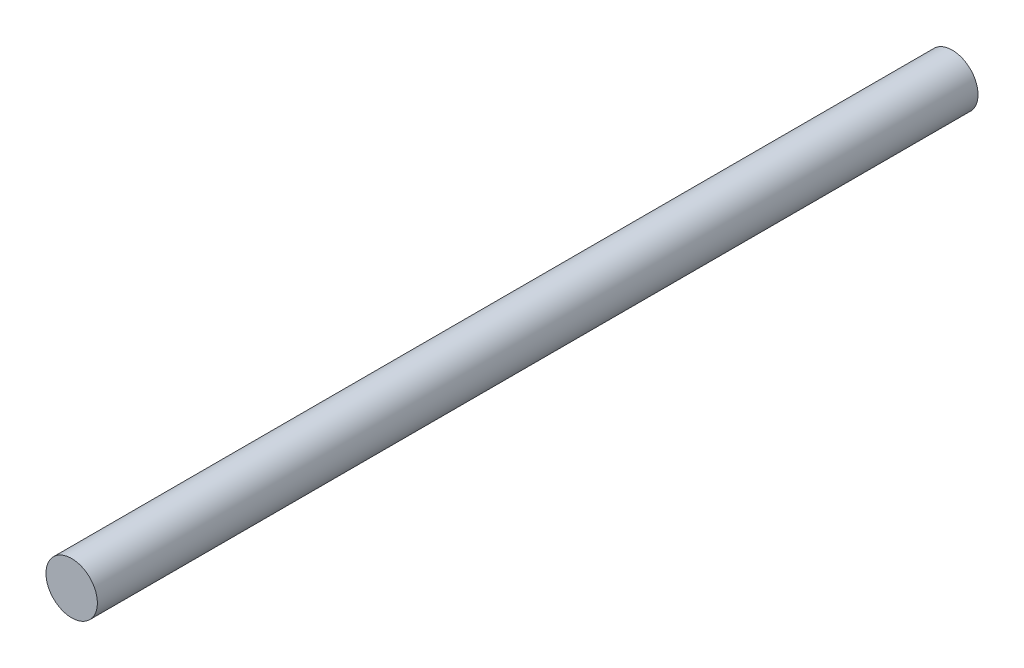
from build123d import *

# Parameters (mm, degrees)
SKETCH1_R      = 7.9375
EXTRUDE1_DEPTH = 135.89


with BuildPart() as part:
    # Sketch1 → Extrude1 (new, symmetric)
    with BuildSketch(Plane.XY):
        Circle(SKETCH1_R)
    extrude(amount=EXTRUDE1_DEPTH, both=True)


solid = part.part
